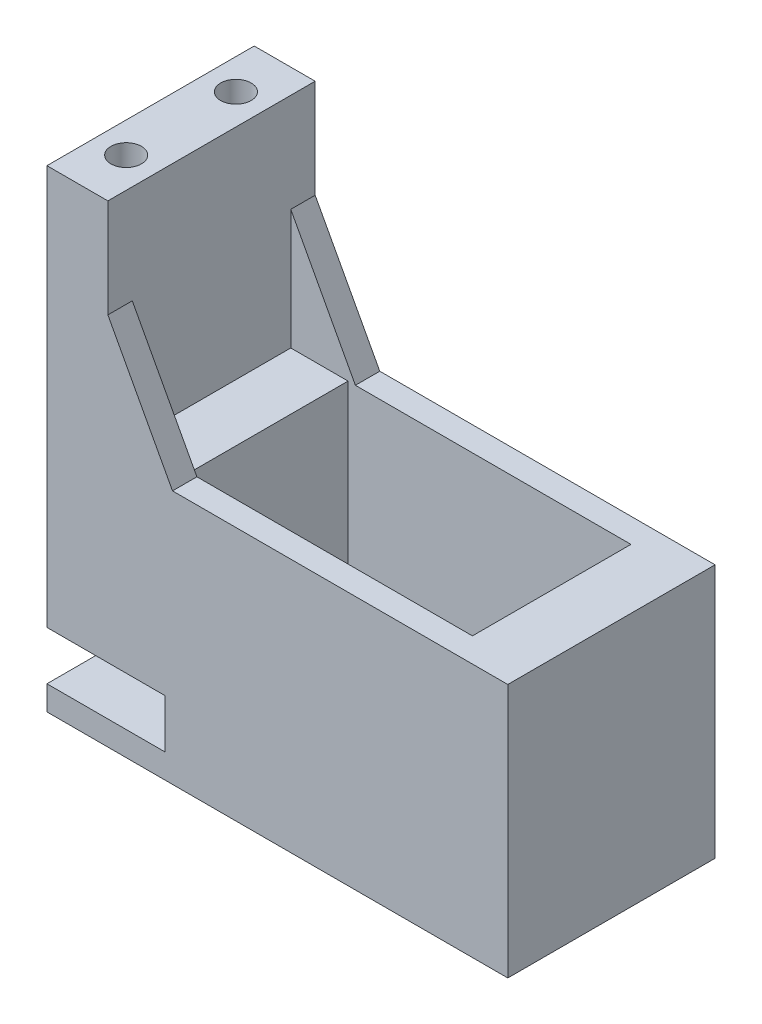
from build123d import *

# Parameters (mm, degrees)
SKETCH1_W               = 37.8
SKETCH1_H               = 20.85
BOSS_EXTRUDE1_DEPTH     = 8.5
SKETCH2_W               = 5
SKETCH2_H               = 17.95
BOSS_EXTRUDE2_DEPTH     = 8.5
SKETCH3_W               = 23.2
SKETCH3_H               = 13
CUT_EXTRUDE1_DEPTH      = 18.85
SKETCH4_W               = 1.4
SKETCH4_H               = 13
CUT_EXTRUDE3_DEPTH      = 5.8
CUT_EXTRUDE4_DEPTH      = 33.550729639
CUT_EXTRUDE4_DEPTH_BACK = 33.550729639
SKETCH5_W               = 9.7
SKETCH5_H               = 4
BOSS_EXTRUDE3_DEPTH     = 8.5
SKETCH7_W               = 5.3
SKETCH7_H               = 13
CUT_EXTRUDE5_DEPTH      = 9.85
SKETCH8_R               = 3
BOSS_EXTRUDE4_DEPTH     = 3
SKETCH9_R               = 1.25
CUT_EXTRUDE6_DEPTH      = 4.3
SKETCH10_R              = 1.25
CUT_EXTRUDE7_DEPTH      = 4.3
SKETCH11_R              = 1.5
BOSS_EXTRUDE5_DEPTH     = 2.8


with BuildPart() as part:
    # Sketch1 → Boss-Extrude1 (new, symmetric)
    with BuildSketch(Plane.XY):
        with Locations((-2.4, -5.275)):
            Rectangle(SKETCH1_W, SKETCH1_H)
    extrude(amount=BOSS_EXTRUDE1_DEPTH, both=True)

    # Sketch2 → Boss-Extrude2 (add, symmetric)
    with BuildSketch(Plane.XY):
        with Locations((-18.8, 14.125)):
            Rectangle(SKETCH2_W, SKETCH2_H)
    extrude(amount=BOSS_EXTRUDE2_DEPTH, both=True)

    # Sketch3 → Cut-Extrude1 (cut)
    with BuildSketch(Plane(origin=(0, 5.15, 0), x_dir=(1, 0, 0), z_dir=(0, 1, 0))):
        Rectangle(SKETCH3_W, SKETCH3_H)
    extrude(amount=-CUT_EXTRUDE1_DEPTH, mode=Mode.SUBTRACT)

    # Sketch4 → Cut-Extrude3 (cut)
    with BuildSketch(Plane(origin=(0, -13.7, 0), x_dir=(1, 0, 0), z_dir=(0, 1, 0))):
        with Locations((12.3, 0)):
            Rectangle(SKETCH4_W, SKETCH4_H)
    extrude(amount=CUT_EXTRUDE3_DEPTH, mode=Mode.SUBTRACT)

    # Sketch5 → Cut-Extrude4 (cut, two sides: drawn at the far end of the back side and taken through both)
    with BuildSketch(Plane.XY.offset(-CUT_EXTRUDE4_DEPTH_BACK)):
        with Locations((-16.45, -11.7)):
            Rectangle(SKETCH5_W, SKETCH5_H)
    extrude(amount=CUT_EXTRUDE4_DEPTH + CUT_EXTRUDE4_DEPTH_BACK, mode=Mode.SUBTRACT)

    # Sketch6 → Boss-Extrude3 (add, symmetric)
    with BuildSketch(Plane.XY):
        Polygon((-16.3, 5.15), (-11, 5.15), (-16.3, 15), align=None)
    extrude(amount=BOSS_EXTRUDE3_DEPTH, both=True)

    # Sketch7 → Cut-Extrude5 (cut)
    with BuildSketch(Plane(origin=(0, 15, 0), x_dir=(1, 0, 0), z_dir=(0, 1, 0))):
        with Locations((-13.65, 0)):
            Rectangle(SKETCH7_W, SKETCH7_H)
    extrude(amount=-CUT_EXTRUDE5_DEPTH, mode=Mode.SUBTRACT)

    # Sketch8 → Boss-Extrude4 (add)
    with BuildSketch(Plane(origin=(0, -18.7, 0), x_dir=(1, 0, 0), z_dir=(0, 1, 0))):
        with Locations(Location((5.5, 0, 0), (0, 0, 270))):
            Circle(SKETCH8_R)
    extrude(amount=BOSS_EXTRUDE4_DEPTH)

    # Sketch9 → Cut-Extrude6 (cut)
    with BuildSketch(Plane(origin=(0, 23.1, 0), x_dir=(1, 0, 0), z_dir=(0, 1, 0))):
        with Locations(Location((-18.8, -4.5, 0), (0, 0, 270))):
            Circle(SKETCH9_R)
    extrude(amount=-CUT_EXTRUDE6_DEPTH, mode=Mode.SUBTRACT)

    # Sketch10 → Cut-Extrude7 (cut)
    with BuildSketch(Plane(origin=(0, 23.1, 0), x_dir=(1, 0, 0), z_dir=(0, 1, 0))):
        with Locations(Location((-18.8, 4.5, 0), (0, 0, 270))):
            Circle(SKETCH10_R)
    extrude(amount=-CUT_EXTRUDE7_DEPTH, mode=Mode.SUBTRACT)

    # Sketch11 → Boss-Extrude5 (add)
    with BuildSketch(Plane(origin=(-24.1, 0, 0), x_dir=(0, 0, -1), z_dir=(1, 0, 0))):
        with Locations((-4, -4)):
            Circle(SKETCH11_R)
        with Locations((4, -4)):
            Circle(SKETCH11_R)
        with Locations((-4, 4)):
            Circle(SKETCH11_R)
        with Locations((4, 4)):
            Circle(SKETCH11_R)
    extrude(amount=BOSS_EXTRUDE5_DEPTH)


solid = part.part
